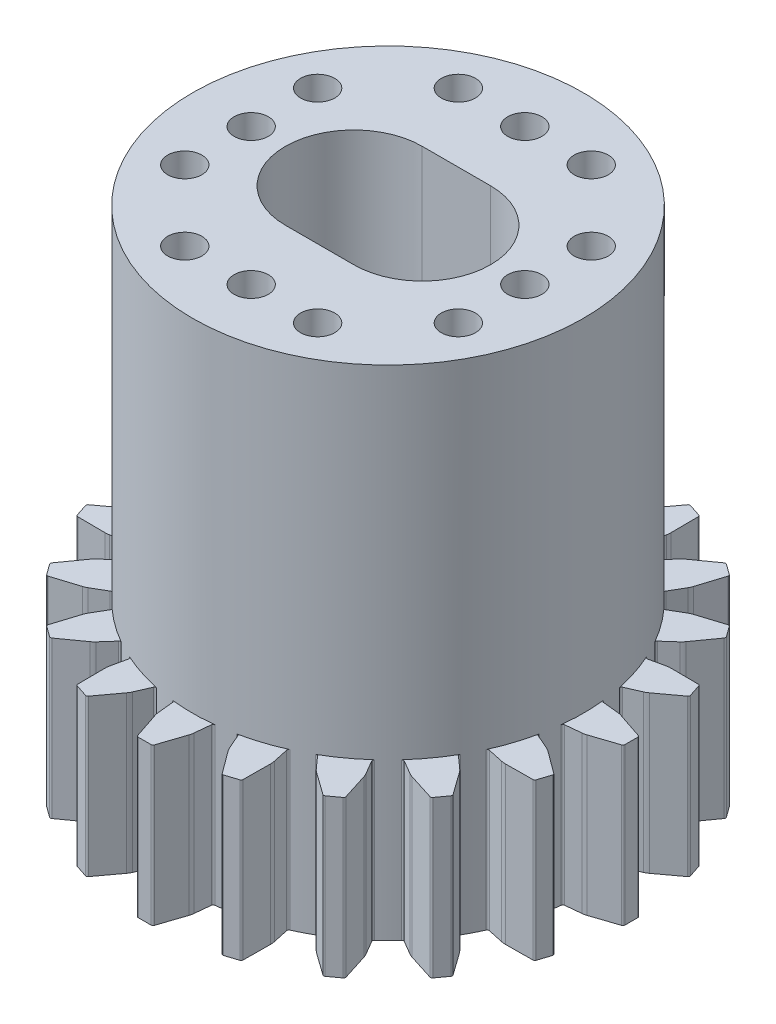
from build123d import *

# Parameters (mm, degrees)
BOSS_EXTRUDE1_DEPTH     = 8
SKETCH2_R               = 8
SKETCH2_R_2             = 5.5
CUT_EXTRUDE1_DEPTH      = 2.9
SKETCH3_R               = 10
BOSS_EXTRUDE2_DEPTH     = 17.5
SKETCH4_R               = 0.875
CUT_EXTRUDE2_DEPTH      = 15
CUT_EXTRUDE5_DEPTH      = 31.987880594
CUT_EXTRUDE5_DEPTH_BACK = 30


with BuildPart() as part:
    # Sketch1 → Boss-Extrude1 (new body)
    with BuildSketch(Plane(origin=(0, 0, 0), x_dir=(1, 0, 0), z_dir=(0, 1, 0))):
        with BuildLine():
            Line((-0.991896595, 10.030908424), (-0.911094624, 10.838928127))
            ThreePointArc((-0.911094624, 10.838928127), (-0.893940179, 10.94857827), (-0.864740732, 11.055652174))
            Line((-0.864740732, 11.055652174), (-0.422792408, 12.381497148))
            ThreePointArc((-0.422792408, 12.381497148), (-0.386395106, 12.43099859), (-0.327924078, 12.449874371))
            Line((-0.327924078, 12.449874371), (0.327924078, 12.449874371))
            ThreePointArc((0.327924078, 12.449874371), (0.386395106, 12.43099859), (0.422792408, 12.381497148))
            Line((0.422792408, 12.381497148), (0.864740732, 11.055652174))
            ThreePointArc((0.864740732, 11.055652174), (0.893940179, 10.94857827), (0.911094624, 10.838928127))
            Line((0.911094624, 10.838928127), (0.991896595, 10.030908424))
            ThreePointArc((0.991896595, 10.030908424), (1.020386157, 9.970452904), (1.08059437, 9.941444352))
            ThreePointArc((1.08059437, 9.941444352), (1.56434465, 9.876883406), (2.044368936, 9.788797457))
            ThreePointArc((2.044368936, 9.788797457), (2.110594485, 9.797780868), (2.156371452, 9.846473725))
            Line((2.156371452, 9.846473725), (2.482910513, 10.589976948))
            ThreePointArc((2.482910513, 10.589976948), (2.533109117, 10.688959415), (2.593967098, 10.781769624))
            Line((2.593967098, 10.781769624), (3.42399356, 11.906153583))
            ThreePointArc((3.42399356, 11.906153583), (3.473906237, 11.941984867), (3.535348427, 11.941868261))
            Line((3.535348427, 11.941868261), (4.15909709, 11.739200035))
            ThreePointArc((4.15909709, 11.739200035), (4.208873405, 11.703179558), (4.228192509, 11.644853505))
            Line((4.228192509, 11.644853505), (4.238801714, 10.24733046))
            ThreePointArc((4.238801714, 10.24733046), (4.233484382, 10.136474001), (4.215915472, 10.026889503))
            Line((4.215915472, 10.026889503), (4.043070892, 9.233447916))
            ThreePointArc((4.043070892, 9.233447916), (4.051484293, 9.167147542), (4.099781571, 9.120953408))
            ThreePointArc((4.099781571, 9.120953408), (4.539904997, 8.910065242), (4.969215167, 8.677954864))
            ThreePointArc((4.969215167, 8.677954864), (5.034975434, 8.666033776), (5.093558837, 8.698197574))
            Line((5.093558837, 8.698197574), (5.633871069, 9.30440504))
            ThreePointArc((5.633871069, 9.30440504), (5.712200044, 9.383030738), (5.798759355, 9.452492342))
            Line((5.798759355, 9.452492342), (6.935615182, 10.26535275))
            ThreePointArc((6.935615182, 10.26535275), (6.994157435, 10.284006461), (7.052556396, 10.264908881))
            Line((7.052556396, 10.264908881), (7.5831487, 9.879411007))
            ThreePointArc((7.5831487, 9.879411007), (7.61935785, 9.829771771), (7.619707668, 9.768330466))
            Line((7.619707668, 9.768330466), (7.197939251, 8.435928644))
            ThreePointArc((7.197939251, 8.435928644), (7.158625637, 8.332141031), (7.108053139, 8.233349072))
            Line((7.108053139, 8.233349072), (6.69848124, 7.532153194))
            ThreePointArc((6.69848124, 7.532153194), (6.685994918, 7.466497906), (6.717653586, 7.407639995))
            ThreePointArc((6.717653586, 7.407639995), (7.071067812, 7.071067812), (7.407639995, 6.717653586))
            ThreePointArc((7.407639995, 6.717653586), (7.466497906, 6.685994918), (7.532153194, 6.69848124))
            Line((7.532153194, 6.69848124), (8.233349072, 7.108053139))
            ThreePointArc((8.233349072, 7.108053139), (8.332141031, 7.158625637), (8.435928644, 7.197939251))
            Line((8.435928644, 7.197939251), (9.768330466, 7.619707668))
            ThreePointArc((9.768330466, 7.619707668), (9.829771771, 7.61935785), (9.879411007, 7.5831487))
            Line((9.879411007, 7.5831487), (10.264908881, 7.052556396))
            ThreePointArc((10.264908881, 7.052556396), (10.284006461, 6.994157435), (10.26535275, 6.935615182))
            Line((10.26535275, 6.935615182), (9.452492342, 5.798759355))
            ThreePointArc((9.452492342, 5.798759355), (9.383030738, 5.712200044), (9.30440504, 5.633871069))
            Line((9.30440504, 5.633871069), (8.698197574, 5.093558837))
            ThreePointArc((8.698197574, 5.093558837), (8.666033776, 5.034975434), (8.677954864, 4.969215167))
            ThreePointArc((8.677954864, 4.969215167), (8.910065242, 4.539904997), (9.120953408, 4.099781571))
            ThreePointArc((9.120953408, 4.099781571), (9.167147542, 4.051484293), (9.233447916, 4.043070892))
            Line((9.233447916, 4.043070892), (10.026889503, 4.215915472))
            ThreePointArc((10.026889503, 4.215915472), (10.136474001, 4.233484382), (10.24733046, 4.238801714))
            Line((10.24733046, 4.238801714), (11.644853505, 4.228192509))
            ThreePointArc((11.644853505, 4.228192509), (11.703179558, 4.208873405), (11.739200035, 4.15909709))
            Line((11.739200035, 4.15909709), (11.941868261, 3.535348427))
            ThreePointArc((11.941868261, 3.535348427), (11.941984867, 3.473906237), (11.906153583, 3.42399356))
            Line((11.906153583, 3.42399356), (10.781769624, 2.593967098))
            ThreePointArc((10.781769624, 2.593967098), (10.688959415, 2.533109117), (10.589976948, 2.482910513))
            Line((10.589976948, 2.482910513), (9.846473725, 2.156371452))
            ThreePointArc((9.846473725, 2.156371452), (9.797780868, 2.110594485), (9.788797457, 2.044368936))
            ThreePointArc((9.788797457, 2.044368936), (9.876883406, 1.56434465), (9.941444352, 1.08059437))
            ThreePointArc((9.941444352, 1.08059437), (9.970452904, 1.020386157), (10.030908424, 0.991896595))
            Line((10.030908424, 0.991896595), (10.838928127, 0.911094624))
            ThreePointArc((10.838928127, 0.911094624), (10.94857827, 0.893940179), (11.055652174, 0.864740732))
            Line((11.055652174, 0.864740732), (12.381497148, 0.422792408))
            ThreePointArc((12.381497148, 0.422792408), (12.43099859, 0.386395106), (12.449874371, 0.327924078))
            Line((12.449874371, 0.327924078), (12.449874371, -0.327924078))
            ThreePointArc((12.449874371, -0.327924078), (12.43099859, -0.386395106), (12.381497148, -0.422792408))
            Line((12.381497148, -0.422792408), (11.055652174, -0.864740732))
            ThreePointArc((11.055652174, -0.864740732), (10.94857827, -0.893940179), (10.838928127, -0.911094624))
            Line((10.838928127, -0.911094624), (10.030908424, -0.991896595))
            ThreePointArc((10.030908424, -0.991896595), (9.970452904, -1.020386157), (9.941444352, -1.08059437))
            ThreePointArc((9.941444352, -1.08059437), (9.876883406, -1.56434465), (9.788797457, -2.044368936))
            ThreePointArc((9.788797457, -2.044368936), (9.797780868, -2.110594485), (9.846473725, -2.156371452))
            Line((9.846473725, -2.156371452), (10.589976948, -2.482910513))
            ThreePointArc((10.589976948, -2.482910513), (10.688959415, -2.533109117), (10.781769624, -2.593967098))
            Line((10.781769624, -2.593967098), (11.906153583, -3.42399356))
            ThreePointArc((11.906153583, -3.42399356), (11.941984867, -3.473906237), (11.941868261, -3.535348427))
            Line((11.941868261, -3.535348427), (11.739200035, -4.15909709))
            ThreePointArc((11.739200035, -4.15909709), (11.703179558, -4.208873405), (11.644853505, -4.228192509))
            Line((11.644853505, -4.228192509), (10.24733046, -4.238801714))
            ThreePointArc((10.24733046, -4.238801714), (10.136474001, -4.233484382), (10.026889503, -4.215915472))
            Line((10.026889503, -4.215915472), (9.233447916, -4.043070892))
            ThreePointArc((9.233447916, -4.043070892), (9.167147542, -4.051484293), (9.120953408, -4.099781571))
            ThreePointArc((9.120953408, -4.099781571), (8.910065242, -4.539904997), (8.677954864, -4.969215167))
            ThreePointArc((8.677954864, -4.969215167), (8.666033776, -5.034975434), (8.698197574, -5.093558837))
            Line((8.698197574, -5.093558837), (9.30440504, -5.633871069))
            ThreePointArc((9.30440504, -5.633871069), (9.383030738, -5.712200044), (9.452492342, -5.798759355))
            Line((9.452492342, -5.798759355), (10.26535275, -6.935615182))
            ThreePointArc((10.26535275, -6.935615182), (10.284006461, -6.994157435), (10.264908881, -7.052556396))
            Line((10.264908881, -7.052556396), (9.879411007, -7.5831487))
            ThreePointArc((9.879411007, -7.5831487), (9.829771771, -7.61935785), (9.768330466, -7.619707668))
            Line((9.768330466, -7.619707668), (8.435928644, -7.197939251))
            ThreePointArc((8.435928644, -7.197939251), (8.332141031, -7.158625637), (8.233349072, -7.108053139))
            Line((8.233349072, -7.108053139), (7.532153194, -6.69848124))
            ThreePointArc((7.532153194, -6.69848124), (7.466497906, -6.685994918), (7.407639995, -6.717653586))
            ThreePointArc((7.407639995, -6.717653586), (7.071067812, -7.071067812), (6.717653586, -7.407639995))
            ThreePointArc((6.717653586, -7.407639995), (6.685994918, -7.466497906), (6.69848124, -7.532153194))
            Line((6.69848124, -7.532153194), (7.108053139, -8.233349072))
            ThreePointArc((7.108053139, -8.233349072), (7.158625637, -8.332141031), (7.197939251, -8.435928644))
            Line((7.197939251, -8.435928644), (7.619707668, -9.768330466))
            ThreePointArc((7.619707668, -9.768330466), (7.61935785, -9.829771771), (7.5831487, -9.879411007))
            Line((7.5831487, -9.879411007), (7.052556396, -10.264908881))
            ThreePointArc((7.052556396, -10.264908881), (6.994157435, -10.284006461), (6.935615182, -10.26535275))
            Line((6.935615182, -10.26535275), (5.798759355, -9.452492342))
            ThreePointArc((5.798759355, -9.452492342), (5.712200044, -9.383030738), (5.633871069, -9.30440504))
            Line((5.633871069, -9.30440504), (5.093558837, -8.698197574))
            ThreePointArc((5.093558837, -8.698197574), (5.034975434, -8.666033776), (4.969215167, -8.677954864))
            ThreePointArc((4.969215167, -8.677954864), (4.539904997, -8.910065242), (4.099781571, -9.120953408))
            ThreePointArc((4.099781571, -9.120953408), (4.051484293, -9.167147542), (4.043070892, -9.233447916))
            Line((4.043070892, -9.233447916), (4.215915472, -10.026889503))
            ThreePointArc((4.215915472, -10.026889503), (4.233484382, -10.136474001), (4.238801714, -10.24733046))
            Line((4.238801714, -10.24733046), (4.228192509, -11.644853505))
            ThreePointArc((4.228192509, -11.644853505), (4.208873405, -11.703179558), (4.15909709, -11.739200035))
            Line((4.15909709, -11.739200035), (3.535348427, -11.941868261))
            ThreePointArc((3.535348427, -11.941868261), (3.473906237, -11.941984867), (3.42399356, -11.906153583))
            Line((3.42399356, -11.906153583), (2.593967098, -10.781769624))
            ThreePointArc((2.593967098, -10.781769624), (2.533109117, -10.688959415), (2.482910513, -10.589976948))
            Line((2.482910513, -10.589976948), (2.156371452, -9.846473725))
            ThreePointArc((2.156371452, -9.846473725), (2.110594485, -9.797780868), (2.044368936, -9.788797457))
            ThreePointArc((2.044368936, -9.788797457), (1.56434465, -9.876883406), (1.08059437, -9.941444352))
            ThreePointArc((1.08059437, -9.941444352), (1.020386157, -9.970452904), (0.991896595, -10.030908424))
            Line((0.991896595, -10.030908424), (0.911094624, -10.838928127))
            ThreePointArc((0.911094624, -10.838928127), (0.893940179, -10.94857827), (0.864740732, -11.055652174))
            Line((0.864740732, -11.055652174), (0.422792408, -12.381497148))
            ThreePointArc((0.422792408, -12.381497148), (0.386395106, -12.43099859), (0.327924078, -12.449874371))
            Line((0.327924078, -12.449874371), (-0.327924078, -12.449874371))
            ThreePointArc((-0.327924078, -12.449874371), (-0.386395106, -12.43099859), (-0.422792408, -12.381497148))
            Line((-0.422792408, -12.381497148), (-0.864740732, -11.055652174))
            ThreePointArc((-0.864740732, -11.055652174), (-0.893940179, -10.94857827), (-0.911094624, -10.838928127))
            Line((-0.911094624, -10.838928127), (-0.991896595, -10.030908424))
            ThreePointArc((-0.991896595, -10.030908424), (-1.020386157, -9.970452904), (-1.08059437, -9.941444352))
            ThreePointArc((-1.08059437, -9.941444352), (-1.56434465, -9.876883406), (-2.044368936, -9.788797457))
            ThreePointArc((-2.044368936, -9.788797457), (-2.110594485, -9.797780868), (-2.156371452, -9.846473725))
            Line((-2.156371452, -9.846473725), (-2.482910513, -10.589976948))
            ThreePointArc((-2.482910513, -10.589976948), (-2.533109117, -10.688959415), (-2.593967098, -10.781769624))
            Line((-2.593967098, -10.781769624), (-3.42399356, -11.906153583))
            ThreePointArc((-3.42399356, -11.906153583), (-3.473906237, -11.941984867), (-3.535348427, -11.941868261))
            Line((-3.535348427, -11.941868261), (-4.15909709, -11.739200035))
            ThreePointArc((-4.15909709, -11.739200035), (-4.208873405, -11.703179558), (-4.228192509, -11.644853505))
            Line((-4.228192509, -11.644853505), (-4.238801714, -10.24733046))
            ThreePointArc((-4.238801714, -10.24733046), (-4.233484382, -10.136474001), (-4.215915472, -10.026889503))
            Line((-4.215915472, -10.026889503), (-4.043070892, -9.233447916))
            ThreePointArc((-4.043070892, -9.233447916), (-4.051484293, -9.167147542), (-4.099781571, -9.120953408))
            ThreePointArc((-4.099781571, -9.120953408), (-4.539904997, -8.910065242), (-4.969215167, -8.677954864))
            ThreePointArc((-4.969215167, -8.677954864), (-5.034975434, -8.666033776), (-5.093558837, -8.698197574))
            Line((-5.093558837, -8.698197574), (-5.633871069, -9.30440504))
            ThreePointArc((-5.633871069, -9.30440504), (-5.712200044, -9.383030738), (-5.798759355, -9.452492342))
            Line((-5.798759355, -9.452492342), (-6.935615182, -10.26535275))
            ThreePointArc((-6.935615182, -10.26535275), (-6.994157435, -10.284006461), (-7.052556396, -10.264908881))
            Line((-7.052556396, -10.264908881), (-7.5831487, -9.879411007))
            ThreePointArc((-7.5831487, -9.879411007), (-7.61935785, -9.829771771), (-7.619707668, -9.768330466))
            Line((-7.619707668, -9.768330466), (-7.197939251, -8.435928644))
            ThreePointArc((-7.197939251, -8.435928644), (-7.158625637, -8.332141031), (-7.108053139, -8.233349072))
            Line((-7.108053139, -8.233349072), (-6.69848124, -7.532153194))
            ThreePointArc((-6.69848124, -7.532153194), (-6.685994918, -7.466497906), (-6.717653586, -7.407639995))
            ThreePointArc((-6.717653586, -7.407639995), (-7.071067812, -7.071067812), (-7.407639995, -6.717653586))
            ThreePointArc((-7.407639995, -6.717653586), (-7.466497906, -6.685994918), (-7.532153194, -6.69848124))
            Line((-7.532153194, -6.69848124), (-8.233349072, -7.108053139))
            ThreePointArc((-8.233349072, -7.108053139), (-8.332141031, -7.158625637), (-8.435928644, -7.197939251))
            Line((-8.435928644, -7.197939251), (-9.768330466, -7.619707668))
            ThreePointArc((-9.768330466, -7.619707668), (-9.829771771, -7.61935785), (-9.879411007, -7.5831487))
            Line((-9.879411007, -7.5831487), (-10.264908881, -7.052556396))
            ThreePointArc((-10.264908881, -7.052556396), (-10.284006461, -6.994157435), (-10.26535275, -6.935615182))
            Line((-10.26535275, -6.935615182), (-9.452492342, -5.798759355))
            ThreePointArc((-9.452492342, -5.798759355), (-9.383030738, -5.712200044), (-9.30440504, -5.633871069))
            Line((-9.30440504, -5.633871069), (-8.698197574, -5.093558837))
            ThreePointArc((-8.698197574, -5.093558837), (-8.666033776, -5.034975434), (-8.677954864, -4.969215167))
            ThreePointArc((-8.677954864, -4.969215167), (-8.910065242, -4.539904997), (-9.120953408, -4.099781571))
            ThreePointArc((-9.120953408, -4.099781571), (-9.167147542, -4.051484293), (-9.233447916, -4.043070892))
            Line((-9.233447916, -4.043070892), (-10.026889503, -4.215915472))
            ThreePointArc((-10.026889503, -4.215915472), (-10.136474001, -4.233484382), (-10.24733046, -4.238801714))
            Line((-10.24733046, -4.238801714), (-11.644853505, -4.228192509))
            ThreePointArc((-11.644853505, -4.228192509), (-11.703179558, -4.208873405), (-11.739200035, -4.15909709))
            Line((-11.739200035, -4.15909709), (-11.941868261, -3.535348427))
            ThreePointArc((-11.941868261, -3.535348427), (-11.941984867, -3.473906237), (-11.906153583, -3.42399356))
            Line((-11.906153583, -3.42399356), (-10.781769624, -2.593967098))
            ThreePointArc((-10.781769624, -2.593967098), (-10.688959415, -2.533109117), (-10.589976948, -2.482910513))
            Line((-10.589976948, -2.482910513), (-9.846473725, -2.156371452))
            ThreePointArc((-9.846473725, -2.156371452), (-9.797780868, -2.110594485), (-9.788797457, -2.044368936))
            ThreePointArc((-9.788797457, -2.044368936), (-9.876883406, -1.56434465), (-9.941444352, -1.08059437))
            ThreePointArc((-9.941444352, -1.08059437), (-9.970452904, -1.020386157), (-10.030908424, -0.991896595))
            Line((-10.030908424, -0.991896595), (-10.838928127, -0.911094624))
            ThreePointArc((-10.838928127, -0.911094624), (-10.94857827, -0.893940179), (-11.055652174, -0.864740732))
            Line((-11.055652174, -0.864740732), (-12.381497148, -0.422792408))
            ThreePointArc((-12.381497148, -0.422792408), (-12.43099859, -0.386395106), (-12.449874371, -0.327924078))
            Line((-12.449874371, -0.327924078), (-12.449874371, 0.327924078))
            ThreePointArc((-12.449874371, 0.327924078), (-12.43099859, 0.386395106), (-12.381497148, 0.422792408))
            Line((-12.381497148, 0.422792408), (-11.055652174, 0.864740732))
            ThreePointArc((-11.055652174, 0.864740732), (-10.94857827, 0.893940179), (-10.838928127, 0.911094624))
            Line((-10.838928127, 0.911094624), (-10.030908424, 0.991896595))
            ThreePointArc((-10.030908424, 0.991896595), (-9.970452904, 1.020386157), (-9.941444352, 1.08059437))
            ThreePointArc((-9.941444352, 1.08059437), (-9.876883406, 1.56434465), (-9.788797457, 2.044368936))
            ThreePointArc((-9.788797457, 2.044368936), (-9.797780868, 2.110594485), (-9.846473725, 2.156371452))
            Line((-9.846473725, 2.156371452), (-10.589976948, 2.482910513))
            ThreePointArc((-10.589976948, 2.482910513), (-10.688959415, 2.533109117), (-10.781769624, 2.593967098))
            Line((-10.781769624, 2.593967098), (-11.906153583, 3.42399356))
            ThreePointArc((-11.906153583, 3.42399356), (-11.941984867, 3.473906237), (-11.941868261, 3.535348427))
            Line((-11.941868261, 3.535348427), (-11.739200035, 4.15909709))
            ThreePointArc((-11.739200035, 4.15909709), (-11.703179558, 4.208873405), (-11.644853505, 4.228192509))
            Line((-11.644853505, 4.228192509), (-10.24733046, 4.238801714))
            ThreePointArc((-10.24733046, 4.238801714), (-10.136474001, 4.233484382), (-10.026889503, 4.215915472))
            Line((-10.026889503, 4.215915472), (-9.233447916, 4.043070892))
            ThreePointArc((-9.233447916, 4.043070892), (-9.167147542, 4.051484293), (-9.120953408, 4.099781571))
            ThreePointArc((-9.120953408, 4.099781571), (-8.910065242, 4.539904997), (-8.677954864, 4.969215167))
            ThreePointArc((-8.677954864, 4.969215167), (-8.666033776, 5.034975434), (-8.698197574, 5.093558837))
            Line((-8.698197574, 5.093558837), (-9.30440504, 5.633871069))
            ThreePointArc((-9.30440504, 5.633871069), (-9.383030738, 5.712200044), (-9.452492342, 5.798759355))
            Line((-9.452492342, 5.798759355), (-10.26535275, 6.935615182))
            ThreePointArc((-10.26535275, 6.935615182), (-10.284006461, 6.994157435), (-10.264908881, 7.052556396))
            Line((-10.264908881, 7.052556396), (-9.879411007, 7.5831487))
            ThreePointArc((-9.879411007, 7.5831487), (-9.829771771, 7.61935785), (-9.768330466, 7.619707668))
            Line((-9.768330466, 7.619707668), (-8.435928644, 7.197939251))
            ThreePointArc((-8.435928644, 7.197939251), (-8.332141031, 7.158625637), (-8.233349072, 7.108053139))
            Line((-8.233349072, 7.108053139), (-7.532153194, 6.69848124))
            ThreePointArc((-7.532153194, 6.69848124), (-7.466497906, 6.685994918), (-7.407639995, 6.717653586))
            ThreePointArc((-7.407639995, 6.717653586), (-7.071067812, 7.071067812), (-6.717653586, 7.407639995))
            ThreePointArc((-6.717653586, 7.407639995), (-6.685994918, 7.466497906), (-6.69848124, 7.532153194))
            Line((-6.69848124, 7.532153194), (-7.108053139, 8.233349072))
            ThreePointArc((-7.108053139, 8.233349072), (-7.158625637, 8.332141031), (-7.197939251, 8.435928644))
            Line((-7.197939251, 8.435928644), (-7.619707668, 9.768330466))
            ThreePointArc((-7.619707668, 9.768330466), (-7.61935785, 9.829771771), (-7.5831487, 9.879411007))
            Line((-7.5831487, 9.879411007), (-7.052556396, 10.264908881))
            ThreePointArc((-7.052556396, 10.264908881), (-6.994157435, 10.284006461), (-6.935615182, 10.26535275))
            Line((-6.935615182, 10.26535275), (-5.798759355, 9.452492342))
            ThreePointArc((-5.798759355, 9.452492342), (-5.712200044, 9.383030738), (-5.633871069, 9.30440504))
            Line((-5.633871069, 9.30440504), (-5.093558837, 8.698197574))
            ThreePointArc((-5.093558837, 8.698197574), (-5.034975434, 8.666033776), (-4.969215167, 8.677954864))
            ThreePointArc((-4.969215167, 8.677954864), (-4.539904997, 8.910065242), (-4.099781571, 9.120953408))
            ThreePointArc((-4.099781571, 9.120953408), (-4.051484293, 9.167147542), (-4.043070892, 9.233447916))
            Line((-4.043070892, 9.233447916), (-4.215915472, 10.026889503))
            ThreePointArc((-4.215915472, 10.026889503), (-4.233484382, 10.136474001), (-4.238801714, 10.24733046))
            Line((-4.238801714, 10.24733046), (-4.228192509, 11.644853505))
            ThreePointArc((-4.228192509, 11.644853505), (-4.208873405, 11.703179558), (-4.15909709, 11.739200035))
            Line((-4.15909709, 11.739200035), (-3.535348427, 11.941868261))
            ThreePointArc((-3.535348427, 11.941868261), (-3.473906237, 11.941984867), (-3.42399356, 11.906153583))
            Line((-3.42399356, 11.906153583), (-2.593967098, 10.781769624))
            ThreePointArc((-2.593967098, 10.781769624), (-2.533109117, 10.688959415), (-2.482910513, 10.589976948))
            Line((-2.482910513, 10.589976948), (-2.156371452, 9.846473725))
            ThreePointArc((-2.156371452, 9.846473725), (-2.110594485, 9.797780868), (-2.044368936, 9.788797457))
            ThreePointArc((-2.044368936, 9.788797457), (-1.56434465, 9.876883406), (-1.08059437, 9.941444352))
            ThreePointArc((-1.08059437, 9.941444352), (-1.020386157, 9.970452904), (-0.991896595, 10.030908424))
        make_face()
    extrude(amount=BOSS_EXTRUDE1_DEPTH)

    # Sketch2 → Cut-Extrude1 (cut)
    with BuildSketch(Plane.XZ):
        Circle(SKETCH2_R)
        Circle(SKETCH2_R_2, mode=Mode.SUBTRACT)
    extrude(amount=-CUT_EXTRUDE1_DEPTH, mode=Mode.SUBTRACT)

    # Sketch3 → Boss-Extrude2 (add)
    with BuildSketch(Plane(origin=(0, 8, 0), x_dir=(1, 0, 0), z_dir=(0, 1, 0))):
        Circle(SKETCH3_R)
    extrude(amount=BOSS_EXTRUDE2_DEPTH)

    # Sketch4 → Cut-Extrude2 (cut)
    with BuildSketch(Plane(origin=(0, 25.5, 0), x_dir=(1, 0, 0), z_dir=(0, 1, 0))):
        with Locations((0, 7)):
            Circle(SKETCH4_R)
        with Locations((3.4, 7)):
            Circle(SKETCH4_R)
        with Locations((-3.4, 7)):
            Circle(SKETCH4_R)
        with Locations((7, 3.4)):
            Circle(SKETCH4_R)
        with Locations((7, 0)):
            Circle(SKETCH4_R)
        with Locations((7, -3.4)):
            Circle(SKETCH4_R)
        with Locations((3.4, -7)):
            Circle(SKETCH4_R)
        with Locations((0, -7)):
            Circle(SKETCH4_R)
        with Locations((-3.4, -7)):
            Circle(SKETCH4_R)
        with Locations((-7, -3.4)):
            Circle(SKETCH4_R)
        with Locations((-7, 0)):
            Circle(SKETCH4_R)
        with Locations((-7, 3.4)):
            Circle(SKETCH4_R)
    extrude(amount=-CUT_EXTRUDE2_DEPTH, mode=Mode.SUBTRACT)

    # Sketch5 → Cut-Extrude5 (cut, two sides: drawn at the far end of the back side and taken through both)
    with BuildSketch(Plane.XZ.offset(-CUT_EXTRUDE5_DEPTH_BACK)):
        with BuildLine():
            Line((-1.75, 3.5), (1.75, 3.5))
            ThreePointArc((1.75, 3.5), (5.25, 0), (1.75, -3.5))
            Line((1.75, -3.5), (-1.75, -3.5))
            ThreePointArc((-1.75, -3.5), (-5.25, 0), (-1.75, 3.5))
        make_face()
    extrude(amount=CUT_EXTRUDE5_DEPTH + CUT_EXTRUDE5_DEPTH_BACK, mode=Mode.SUBTRACT)


solid = part.part
